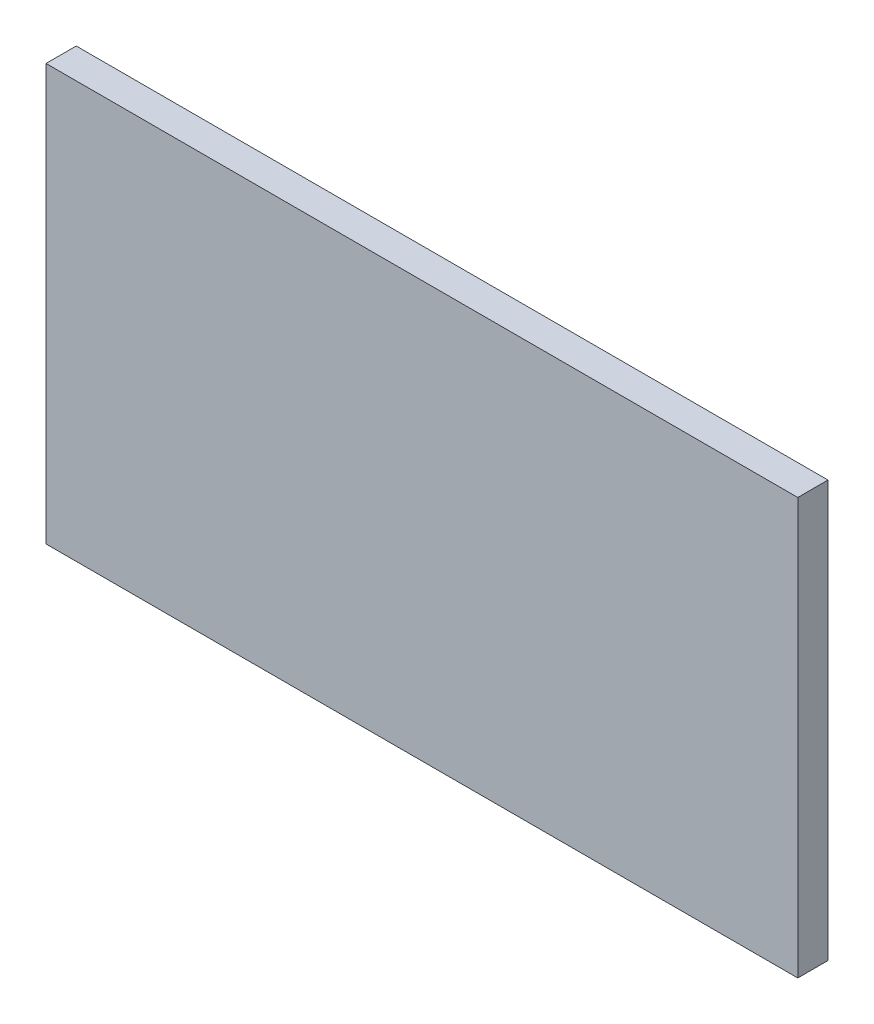
from build123d import *

# Parameters (mm, degrees)
SKETCH1_W           = 448
SKETCH1_H           = 248
BOSS_EXTRUDE1_DEPTH = 9


with BuildPart() as part:
    # Sketch1 → Boss-Extrude1 (new, symmetric)
    with BuildSketch(Plane.XY):
        with Locations((224, 124)):
            Rectangle(SKETCH1_W, SKETCH1_H)
    extrude(amount=BOSS_EXTRUDE1_DEPTH, both=True)


solid = part.part
